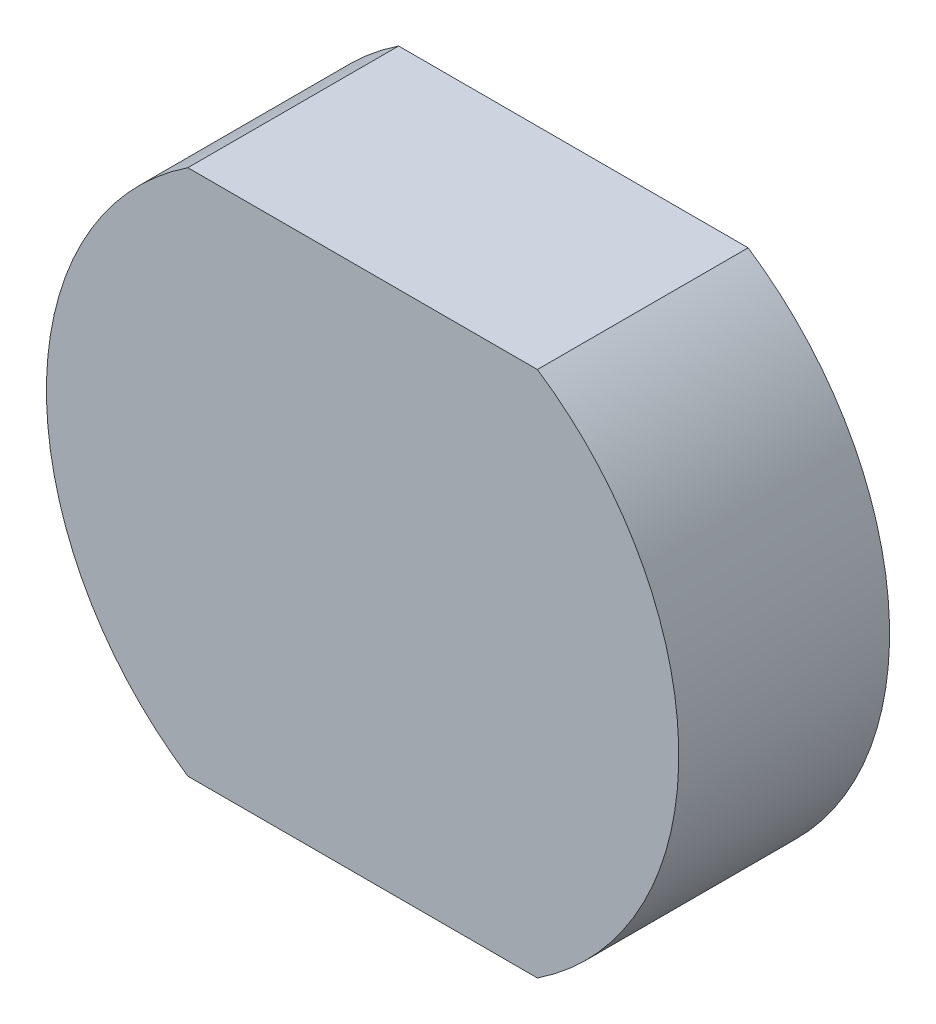
from build123d import *

# Parameters (mm, degrees)
EXTRUDE_1_DEPTH = 10


with BuildPart() as part:
    # Эскиз1 → Бобышка-Вытянуть1 (new body)
    with BuildSketch(Plane.XY):
        with BuildLine():
            Line((-8.291561976, 12.5), (8.291561976, 12.5))
            ThreePointArc((8.291561976, 12.5), (15, 0), (8.291561976, -12.5))
            Line((8.291561976, -12.5), (-8.291561976, -12.5))
            ThreePointArc((-8.291561976, -12.5), (-15, 0), (-8.291561976, 12.5))
        make_face()
    extrude(amount=EXTRUDE_1_DEPTH)


solid = part.part
